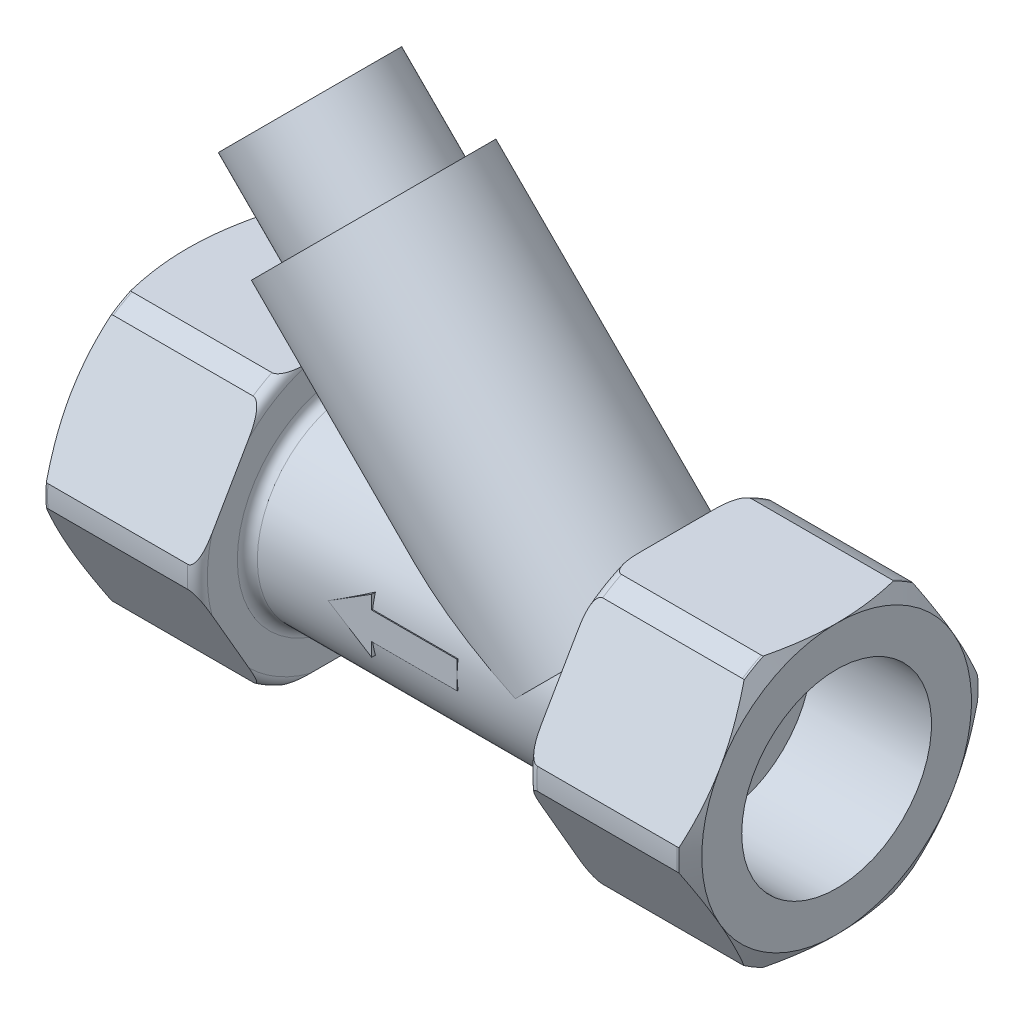
from build123d import *

# Parameters (mm, degrees)
SKIZZE2_OUTSIDE_W               = 47.524
SKIZZE2_OUTSIDE_H               = 47.524
SCHNITT_LINEAR_AUSTRAGEN1_DEPTH = 16
SKIZZE3_OUTSIDE_W               = 220.49
SKIZZE3_OUTSIDE_H               = 217.49
SKIZZE3_OUTSIDE_R               = 13.5
SCHNITT_LINEAR_AUSTRAGEN2_DEPTH = 48
SCHNITT_LINEAR_AUSTRAGEN2_DRAFT = -61
SPIEGELN2_COPY_1_SKETCH_W       = 220.49
SPIEGELN2_COPY_1_SKETCH_H       = 217.49
SPIEGELN2_COPY_1_SKETCH_R       = 13.5
SPIEGELN2_COPY_1_DEPTH          = 48
SPIEGELN2_COPY_1_DRAFT          = -61
LINEAR_AUSTRAGEN1_DEPTH         = 10


with BuildPart() as part:
    # Skizze1 → Basis-Rotation (revolve)
    with BuildSketch(Plane.XY, mode=Mode.PRIVATE) as basis_rotation_sk:
        with BuildLine():
            Line((-15.5, 10), (15.5, 10))
            ThreePointArc((15.5, 10), (16.207106781, 10.292893219), (16.5, 11))
            Line((16.5, 11), (16.5, 14))
            ThreePointArc((16.5, 14), (16.792893219, 14.707106781), (17.5, 15))
            Line((17.5, 15), (31.5, 15))
            ThreePointArc((31.5, 15), (32.207106781, 14.707106781), (32.5, 14))
            Line((32.5, 14), (32.5, 9.5))
            Line((32.5, 9.5), (20.5, 9.5))
            Line((20.5, 9.5), (20.5, 7))
            Line((20.5, 7), (-20.5, 7))
            Line((-20.5, 7), (-20.5, 9.5))
            Line((-20.5, 9.5), (-32.5, 9.5))
            Line((-32.5, 9.5), (-32.5, 14))
            ThreePointArc((-32.5, 14), (-32.207106781, 14.707106781), (-31.5, 15))
            Line((-31.5, 15), (-17.5, 15))
            ThreePointArc((-17.5, 15), (-16.792893219, 14.707106781), (-16.5, 14))
            Line((-16.5, 14), (-16.5, 11))
            ThreePointArc((-16.5, 11), (-16.207106781, 10.292893219), (-15.5, 10))
        make_face()
    revolve(basis_rotation_sk.sketch.rotate(Axis((-52.931557789, 0, 0), (1, 0, 0)), 90), axis=Axis((-52.931557789, 0, 0), (1, 0, 0)))

    # Skizze2 outside → Schnitt-Linear austragen1 (cut)
    with BuildSketch(Plane.ZY.offset(32.5)):
        Rectangle(SKIZZE2_OUTSIDE_W, SKIZZE2_OUTSIDE_H)
        Polygon((15.588457268, 0), (7.794228634, 13.5), (-7.794228634, 13.5), (-15.588457268, 0), (-7.794228634, -13.5), (7.794228634, -13.5), align=None, mode=Mode.SUBTRACT)
    schnitt_linear_austragen1 = extrude(amount=-SCHNITT_LINEAR_AUSTRAGEN1_DEPTH, mode=Mode.SUBTRACT)

    # Spiegeln1: Schnitt-Linear austragen1 across plane
    add(schnitt_linear_austragen1.mirror(Plane(origin=(0, 0, 0), x_dir=(0, 0, 1), z_dir=(1, 0, 0))), mode=Mode.SUBTRACT)


with BuildPart() as schnitt_linear_austragen2_tool:
    # Skizze3 outside → Schnitt-Linear austragen2 (with draft: the straight prism first)
    with BuildSketch(Plane.ZY.offset(32.5)):
        Rectangle(SKIZZE3_OUTSIDE_W, SKIZZE3_OUTSIDE_H)
        Circle(SKIZZE3_OUTSIDE_R, mode=Mode.SUBTRACT)
    extrude(amount=-SCHNITT_LINEAR_AUSTRAGEN2_DEPTH)
    # Schnitt-Linear austragen2: the draft: its side faces are tilted about the plane it starts from
    schnitt_linear_austragen2_sides = [schnitt_linear_austragen2_tool.faces().sort_by_distance(p)[0] for p in [
        (-8.5, -108.745, 0),
        (-8.5, 0, 110.245),
        (-8.5, 108.745, 0),
        (-8.5, 0, -110.245),
        (-8.5, 0, -13.5),
    ]]
    draft(schnitt_linear_austragen2_sides, Plane.ZY.offset(32.5), SCHNITT_LINEAR_AUSTRAGEN2_DRAFT)


with BuildPart() as part_1:
    add(part.part)

    # Schnitt-Linear austragen2: cut by schnitt_linear_austragen2_tool
    add(schnitt_linear_austragen2_tool.part, mode=Mode.SUBTRACT)


with BuildPart() as spiegeln2_copy_1_tool:
    # Spiegeln2 copy 1 sketch → Spiegeln2 copy 1 (with draft: the straight prism first)
    with BuildSketch(Plane(origin=(32.5, 0, 0), x_dir=(0, 0, 1), z_dir=(1, 0, 0))):
        Rectangle(SPIEGELN2_COPY_1_SKETCH_W, SPIEGELN2_COPY_1_SKETCH_H)
        Circle(SPIEGELN2_COPY_1_SKETCH_R, mode=Mode.SUBTRACT)
    extrude(amount=-SPIEGELN2_COPY_1_DEPTH)
    # Spiegeln2 copy 1: the draft: its side faces are tilted about the plane it starts from
    spiegeln2_copy_1_sides = [spiegeln2_copy_1_tool.faces().sort_by_distance(p)[0] for p in [
        (8.5, -108.745, 0),
        (8.5, 0, 110.245),
        (8.5, 108.745, 0),
        (8.5, 0, -110.245),
        (8.5, 0, -13.5),
    ]]
    draft(spiegeln2_copy_1_sides, Plane(origin=(32.5, 0, 0), x_dir=(0, 0, 1), z_dir=(1, 0, 0)), SPIEGELN2_COPY_1_DRAFT)


with BuildPart() as part_2:
    add(part_1.part)

    # Spiegeln2 copy 1: cut by spiegeln2_copy_1_tool
    add(spiegeln2_copy_1_tool.part, mode=Mode.SUBTRACT)

    # Skizze7 → Aufsatz-Rotationskörper1 (revolve)
    with BuildSketch(Plane.XY):
        Polygon((-8.556513139, 31.480970389), (-6.788746186, 33.248737342), (17.959991156, 8.5), (10.888923344, 1.428932188), (-20.223775028, 32.54163056), (-14.920474169, 37.844931419), align=None)
    revolve(axis=Axis((12.772411305, -0.454555773, 0), (-0.7071067811865476, 0.7071067811865475, 0)))

    # Skizze11 → Linear austragen1 (add, symmetric)
    with BuildSketch(Plane.XY):
        Polygon((-8.407064645, 0), (-4.050676601, 2.73362495), (-4.050676601, 1.366812475), (4.509243764, 1.366812475), (4.509243764, -1.366812475), (-4.050676601, -1.366812475), (-4.050676601, -2.73362495), align=None)
    extrude(amount=LINEAR_AUSTRAGEN1_DEPTH, both=True)


solid = part_2.part
